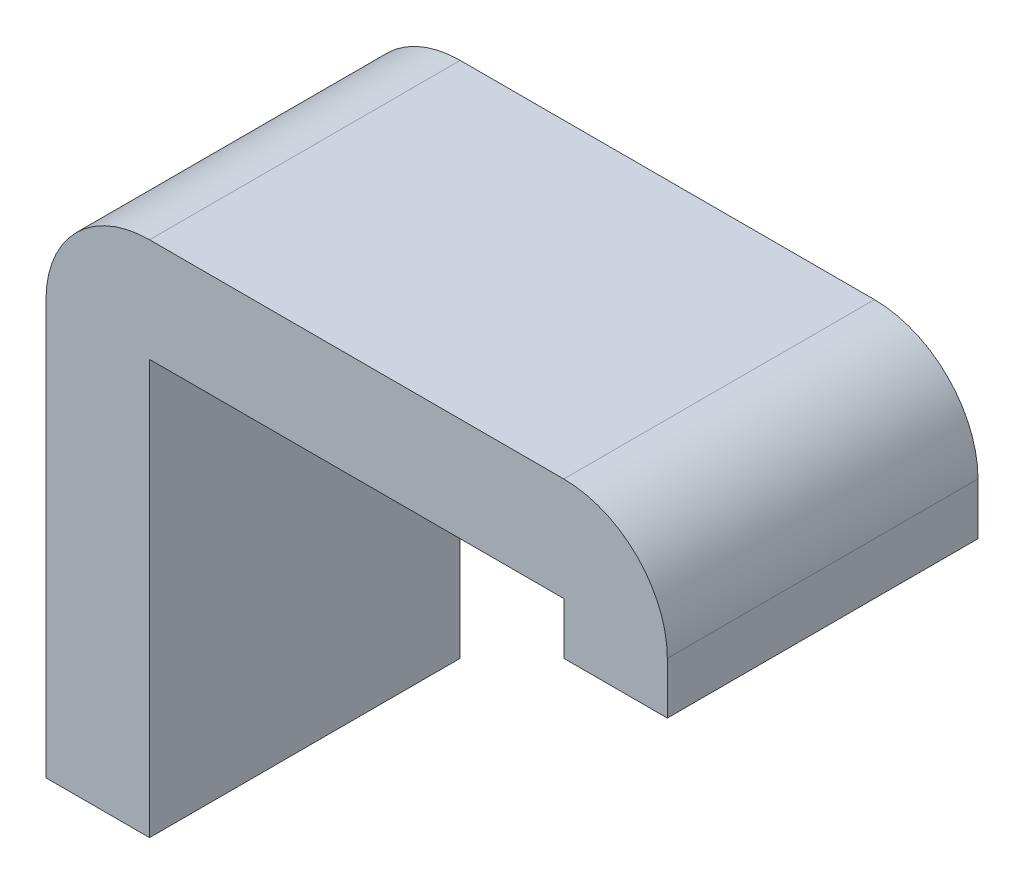
from build123d import *

# Parameters (mm, degrees)
EXTRU_MINCE3_DEPTH      = 30
ESQUISSE9_W             = 6.386782908
ESQUISSE9_H             = 25.842816024
ENL_V_MAT_EXTRU_1_DEPTH = 40
ESQUISSE10_W            = 5.204045332
ESQUISSE10_H            = 24.186983419
ENL_V_MAT_EXTRU_2_DEPTH = 10


with BuildPart() as part:
    # Esquisse5 → Extru.-Mince3 (new body)
    with BuildSketch(Plane.XY):
        with BuildLine():
            Line((-30, -50), (-30, -10))
            ThreePointArc((-30, -10), (-27.071067812, -2.928932188), (-20, 0))
            Line((-20, 0), (20, 0))
            ThreePointArc((20, 0), (27.071067812, -2.928932188), (30, -10))
            Line((30, -10), (30, -15))
            Line((30, -15), (20, -15))
            Line((20, -15), (20, -10))
            Line((20, -10), (-20, -10))
            Line((-20, -10), (-20, -50))
            Line((-20, -50), (-30, -50))
        make_face()
    extrude(amount=EXTRU_MINCE3_DEPTH)

    # Esquisse9 → Enlèv. mat.-Extru.1 (cut)
    with BuildSketch(Plane.XZ.offset(50)):
        with Locations((-25.133173479, 15.236547515)):
            Rectangle(ESQUISSE9_W, ESQUISSE9_H)
    extrude(amount=-ENL_V_MAT_EXTRU_1_DEPTH, mode=Mode.SUBTRACT)

    # Esquisse10 → Enlèv. mat.-Extru.2 (cut)
    with BuildSketch(Plane.XZ.offset(15)):
        with Locations((24.778352206, 15.177410637)):
            Rectangle(ESQUISSE10_W, ESQUISSE10_H)
    extrude(amount=-ENL_V_MAT_EXTRU_2_DEPTH, mode=Mode.SUBTRACT)


solid = part.part
